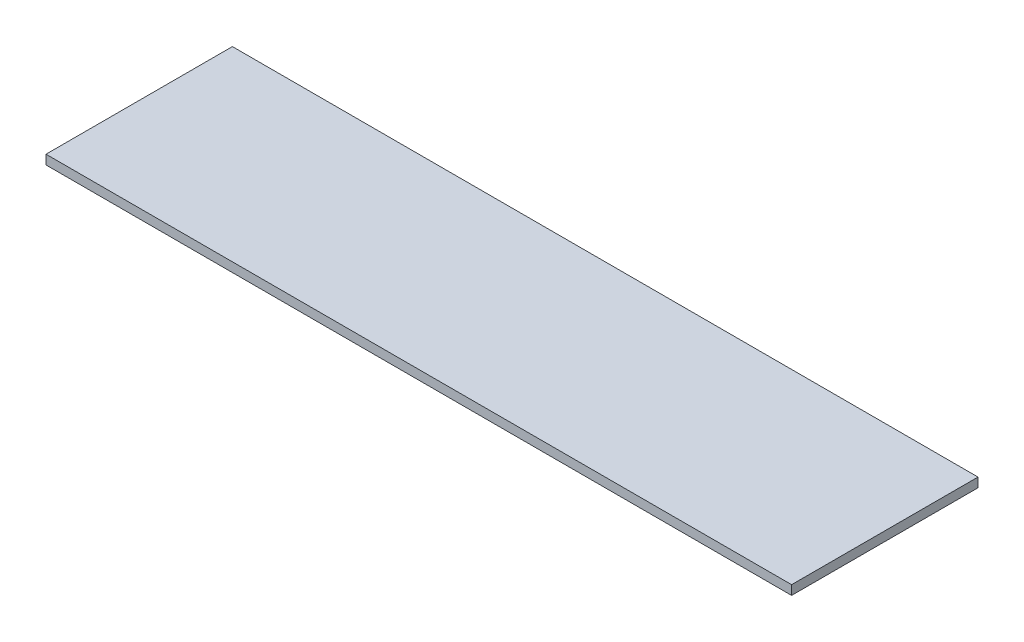
from build123d import *

# Parameters (mm, degrees)
SKETCH1_W           = 400
SKETCH1_H           = 100
BOSS_EXTRUDE1_DEPTH = 5


with BuildPart() as part:
    # Sketch1 → Boss-Extrude1 (new body)
    with BuildSketch(Plane(origin=(0, 0, 0), x_dir=(1, 0, 0), z_dir=(0, 1, 0))):
        Rectangle(SKETCH1_W, SKETCH1_H)
    extrude(amount=BOSS_EXTRUDE1_DEPTH)


solid = part.part
